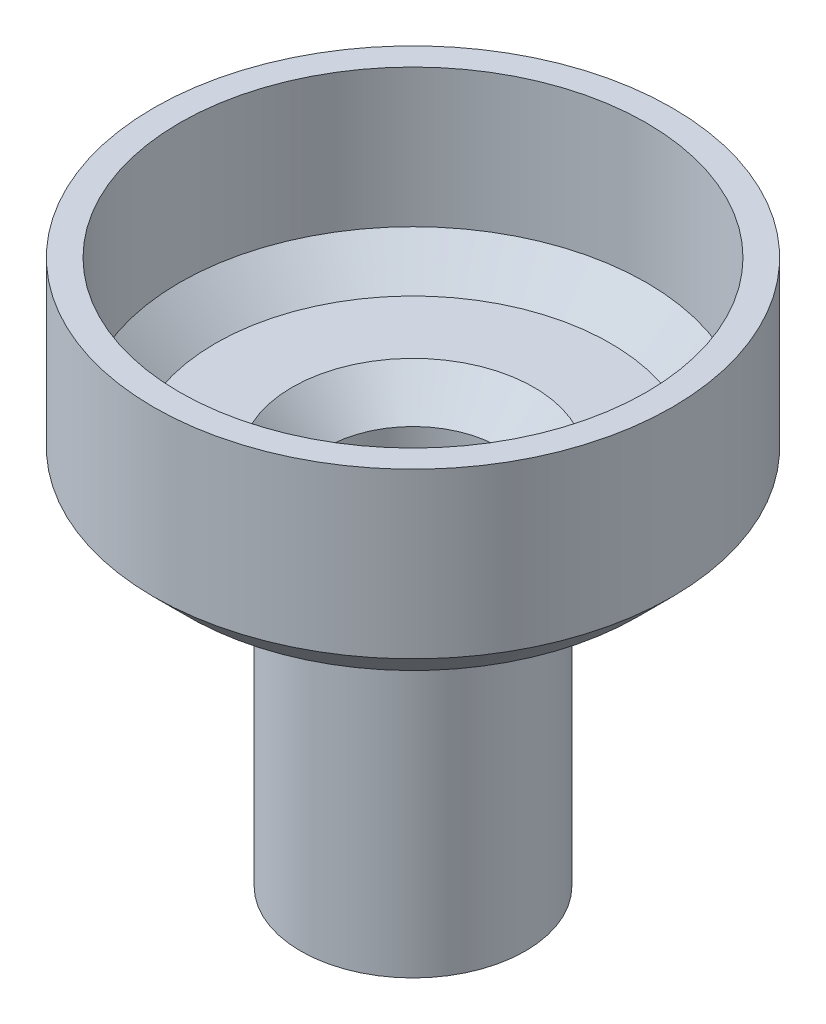
from build123d import *

# Parameters (mm, degrees)
SKETCH_2_R          = 2
CUT_EXTRUDE_1_DEPTH = 1.5


with BuildPart() as part:
    # 草图1 → 旋转3 (revolve)
    with BuildSketch(Plane.XY):
        Polygon((0, 0), (5, 0), (5, 18), (7, 20), (11.418621451, 20), (13.5, 22), (13.5, 30), (15, 30), (15, 20.5), (13, 18.5), (8.5, 18.5), (6.5, 16.5), (6.5, -1.5), (5, -1.5), (0, -1.5), align=None)
    revolve(axis=Axis((0, -297.326720661, 0), (0, 1, 0)))

    # 草图2 → 切除-拉伸1 (cut)
    with BuildSketch(Plane(origin=(0, 0, 0), x_dir=(1, 0, 0), z_dir=(0, 1, 0))):
        with Locations(Location((0, 0, 0), (0, 0, 180))):
            Circle(SKETCH_2_R)
    extrude(amount=-CUT_EXTRUDE_1_DEPTH, mode=Mode.SUBTRACT)


solid = part.part
